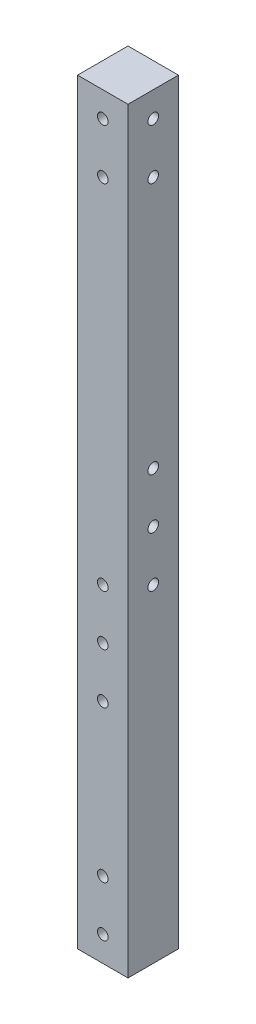
from build123d import *

# Parameters (mm, degrees)
SKETCH_1_W          = 20
SKETCH_1_H          = 20
EXTRUDE_1_DEPTH     = 300
SKETCH_2_R          = 2.1
CUT_EXTRUDE_1_DEPTH = 301.83217913
SKETCH_4_R          = 2.1
CUT_EXTRUDE_2_DEPTH = 301.83217913
SKETCH_5_R          = 2.1
CUT_EXTRUDE_3_DEPTH = 301.83217913
SKETCH_6_R          = 2.1
CUT_EXTRUDE_4_DEPTH = 301.83217913


with BuildPart() as part:
    # 草图1 → 凸台-拉伸1 (new body)
    with BuildSketch(Plane(origin=(0, 0, 0), x_dir=(1, 0, 0), z_dir=(0, 1, 0))):
        Rectangle(SKETCH_1_W, SKETCH_1_H)
    extrude(amount=EXTRUDE_1_DEPTH)

    # 草图2 → 切除-拉伸1 (cut, through all)
    with BuildSketch(Plane.XY.offset(10)):
        with Locations((0, 10)):
            Circle(SKETCH_2_R)
        with Locations((0, 30)):
            Circle(SKETCH_2_R)
        with Locations(Location((0, 270, 0), (0, 0, 180))):
            Circle(SKETCH_2_R)
        with Locations(Location((0, 290, 0), (0, 0, 180))):
            Circle(SKETCH_2_R)
    extrude(amount=-CUT_EXTRUDE_1_DEPTH, mode=Mode.SUBTRACT)

    # 草图4 → 切除-拉伸2 (cut, through all)
    with BuildSketch(Plane.ZY.offset(10)):
        with Locations((0, 130)):
            Circle(SKETCH_4_R)
        with Locations((0, 150)):
            Circle(SKETCH_4_R)
        with Locations((0, 170)):
            Circle(SKETCH_4_R)
    extrude(amount=-CUT_EXTRUDE_2_DEPTH, mode=Mode.SUBTRACT)

    # 草图5 → 切除-拉伸3 (cut, through all)
    with BuildSketch(Plane(origin=(10, 0, 0), x_dir=(0, 0, -1), z_dir=(1, 0, 0))):
        with Locations((0, 290)):
            Circle(SKETCH_5_R)
        with Locations((0, 270)):
            Circle(SKETCH_5_R)
    extrude(amount=-CUT_EXTRUDE_3_DEPTH, mode=Mode.SUBTRACT)

    # 草图6 → 切除-拉伸4 (cut, through all)
    with BuildSketch(Plane(origin=(0, 0, -10), x_dir=(-1, 0, 0), z_dir=(0, 0, -1))):
        with Locations((0, 90)):
            Circle(SKETCH_6_R)
        with Locations((0, 110)):
            Circle(SKETCH_6_R)
        with Locations((0, 130)):
            Circle(SKETCH_6_R)
    extrude(amount=-CUT_EXTRUDE_4_DEPTH, mode=Mode.SUBTRACT)


solid = part.part
